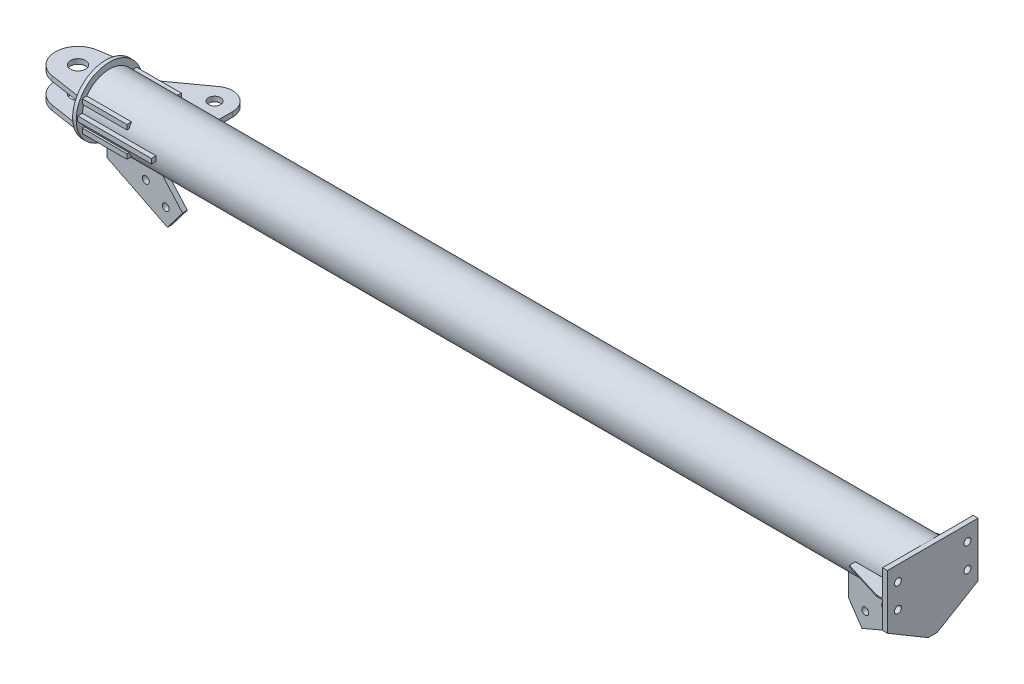
from build123d import *

# Parameters (mm, degrees)
SKETCH_2_R           = 90
EXTRUDE_1_DEPTH      = 2710
EXTRUDE_2_DEPTH      = 16
SKETCH_4_R           = 11.5
CUT_EXTRUDE_1_DEPTH  = 2736.411486413
SKETCH_5_W           = 300
SKETCH_5_H           = 4
EXTRUDE_3_DEPTH      = 150
CUT_EXTRUDE_2_DEPTH  = 2736.287919032
SKETCH_7_W           = 16
SKETCH_7_H           = 260
EXTRUDE_4_DEPTH      = 255
CUT_EXTRUDE_3_DEPTH  = 2743.925445578
CUT_EXTRUDE_4_DEPTH  = 2743.925445578
SKETCH_11_R          = 11.5
CUT_EXTRUDE_5_DEPTH  = 2743.925445578
SKETCH_12_R          = 110
EXTRUDE_5_DEPTH      = 12
SKETCH_14_W          = 16
SKETCH_14_H          = 260
EXTRUDE_6_DEPTH      = 250
CUT_EXTRUDE_7_DEPTH  = 2743.925445578
CUT_EXTRUDE_8_DEPTH  = 2743.925445578
SKETCH_17_R          = 11.5
CUT_EXTRUDE_9_DEPTH  = 2743.925445578
SKETCH_18_W          = 180
SKETCH_18_H          = 16
EXTRUDE_7_DEPTH      = 167
CUT_EXTRUDE_10_DEPTH = 2739.188452244
CUT_EXTRUDE_11_DEPTH = 2739.188452244
SKETCH_21_R          = 25
CUT_EXTRUDE_12_DEPTH = 2739.188452244
SKETCH_22_W          = 180
SKETCH_22_H          = 16
EXTRUDE_8_DEPTH      = 160
SKETCH_23_W          = 244
SKETCH_23_H          = 16
EXTRUDE_9_DEPTH      = 329
CUT_EXTRUDE_13_DEPTH = 2747.77192355
CUT_EXTRUDE_14_DEPTH = 2747.77192355
SKETCH_27_R          = 20
CUT_EXTRUDE_15_DEPTH = 2747.77192355


with BuildPart() as part:
    # 草图2 → 凸台-拉伸1 (new body)
    with BuildSketch(Plane(origin=(0, 0, 0), x_dir=(0, 0, -1), z_dir=(1, 0, 0))):
        Circle(SKETCH_2_R)
    extrude(amount=EXTRUDE_1_DEPTH)

    # 草图3 → 凸台-拉伸2 (add)
    with BuildSketch(Plane(origin=(2710, 0, 0), x_dir=(0, 0, -1), z_dir=(1, 0, 0))):
        Polygon((-150, 90), (150, 90), (150, -90), (15, -170), (-15, -170), (-150, -90), align=None)
    extrude(amount=EXTRUDE_2_DEPTH)

    # 草图4 → 切除-拉伸1 (cut, through all)
    with BuildSketch(Plane(origin=(2726, 0, 0), x_dir=(0, 0, -1), z_dir=(1, 0, 0))):
        with Locations((115, -40)):
            Circle(SKETCH_4_R)
        with Locations((115, 40)):
            Circle(SKETCH_4_R)
        with Locations((-115, 40)):
            Circle(SKETCH_4_R)
        with Locations((-115, -40)):
            Circle(SKETCH_4_R)
    extrude(amount=-CUT_EXTRUDE_1_DEPTH, mode=Mode.SUBTRACT)

    # 草图5 → 凸台-拉伸3 (add)
    with BuildSketch(Plane.ZY.offset(-2710)):
        Rectangle(SKETCH_5_W, SKETCH_5_H)
    extrude(amount=EXTRUDE_3_DEPTH)

    # 草图6 → 切除-拉伸2 (cut, through all)
    with BuildSketch(Plane.XZ.offset(2)):
        Polygon((2690, 150), (2560, 109.977775034), (2560, 150), align=None)
        Polygon((2560, -109.977775034), (2560, -150), (2690, -150), align=None)
    extrude(amount=-CUT_EXTRUDE_2_DEPTH, mode=Mode.SUBTRACT)

    # 草图7 → 凸台-拉伸4 (add)
    with BuildSketch(Plane.ZY.offset(-2710)):
        with Locations((0, -130)):
            Rectangle(SKETCH_7_W, SKETCH_7_H)
    extrude(amount=EXTRUDE_4_DEPTH)

    # 草图9 → 切除-拉伸3 (cut, through all)
    with BuildSketch(Plane(origin=(0, 0, -8), x_dir=(-1, 0, 0), z_dir=(0, 0, -1))):
        Polygon((-2710, -260), (-2500, -260), (-2710, -170), align=None)
    extrude(amount=-CUT_EXTRUDE_3_DEPTH, mode=Mode.SUBTRACT)

    # 草图10 → 切除-拉伸4 (cut, through all)
    with BuildSketch(Plane(origin=(0, 0, -8), x_dir=(-1, 0, 0), z_dir=(0, 0, -1))):
        Polygon((-2500, -260), (-2455, -194), (-2455, -260), align=None)
    extrude(amount=-CUT_EXTRUDE_4_DEPTH, mode=Mode.SUBTRACT)

    # 草图11 → 切除-拉伸5 (cut, through all)
    with BuildSketch(Plane(origin=(0, 0, -8), x_dir=(-1, 0, 0), z_dir=(0, 0, -1))):
        with Locations((-2576.544239322, -159.650616434)):
            Circle(SKETCH_11_R)
        with Locations((-2510.599342676, -204.94157145)):
            Circle(SKETCH_11_R)
    extrude(amount=-CUT_EXTRUDE_5_DEPTH, mode=Mode.SUBTRACT)

    # 草图12 → 凸台-拉伸5 (add)
    with BuildSketch(Plane.ZY):
        Circle(SKETCH_12_R)
    extrude(amount=EXTRUDE_5_DEPTH)

    # 草图14 → 凸台-拉伸6 (add)
    with BuildSketch(Plane(origin=(0, 0, 0), x_dir=(0, 0, -1), z_dir=(1, 0, 0))):
        with Locations((0, -130)):
            Rectangle(SKETCH_14_W, SKETCH_14_H)
    extrude(amount=EXTRUDE_6_DEPTH)

    # 草图15 → 切除-拉伸7 (cut, through all)
    with BuildSketch(Plane(origin=(0, 0, -8), x_dir=(-1, 0, 0), z_dir=(0, 0, -1))):
        Polygon((-250, -194), (-250, -89.643739324), (-158, -89.643739324), align=None)
        Polygon((-200, -260), (0, -160), (0, -260), align=None)
    extrude(amount=-CUT_EXTRUDE_7_DEPTH, mode=Mode.SUBTRACT)

    # 草图16 → 切除-拉伸8 (cut, through all)
    with BuildSketch(Plane(origin=(0, 0, -8), x_dir=(-1, 0, 0), z_dir=(0, 0, -1))):
        Polygon((-250, -260), (-200, -260), (-250, -194), align=None)
    extrude(amount=-CUT_EXTRUDE_8_DEPTH, mode=Mode.SUBTRACT)

    # 草图17 → 切除-拉伸9 (cut, through all)
    with BuildSketch(Plane(origin=(0, 0, -8), x_dir=(-1, 0, 0), z_dir=(0, 0, -1))):
        with Locations((-128.455760678, -159.650616434)):
            Circle(SKETCH_17_R)
        with Locations((-194.400657324, -204.94157145)):
            Circle(SKETCH_17_R)
    extrude(amount=-CUT_EXTRUDE_9_DEPTH, mode=Mode.SUBTRACT)

    # 草图18 → 凸台-拉伸7 (add)
    with BuildSketch(Plane.ZY.offset(12)):
        with Locations((0, 42)):
            Rectangle(SKETCH_18_W, SKETCH_18_H)
        with Locations((0, -42)):
            Rectangle(SKETCH_18_W, SKETCH_18_H)
    extrude(amount=EXTRUDE_7_DEPTH)

    # 草图19 → 切除-拉伸10 (cut, through all)
    with BuildSketch(Plane.XZ.offset(50)):
        with BuildLine():
            Line((-115.378912249, 74.131776965), (-12, 90))
            Line((-12, 90), (-179, 90))
            Line((-179, 90), (-179, 0))
            ThreePointArc((-179, 0), (-160.914051071, 48.844557431), (-115.378912249, 74.131776965))
        make_face()
    extrude(amount=-CUT_EXTRUDE_10_DEPTH, mode=Mode.SUBTRACT)

    # 草图20 → 切除-拉伸11 (cut, through all)
    with BuildSketch(Plane.XZ.offset(50)):
        with BuildLine():
            Line((-115.378912249, -74.131776965), (-12, -90))
            Line((-12, -90), (-179, -90))
            Line((-179, -90), (-179, 0))
            ThreePointArc((-179, 0), (-160.914051071, -48.844557431), (-115.378912249, -74.131776965))
        make_face()
    extrude(amount=-CUT_EXTRUDE_11_DEPTH, mode=Mode.SUBTRACT)

    # 草图21 → 切除-拉伸12 (cut, through all)
    with BuildSketch(Plane.XZ.offset(50)):
        with Locations((-104, 0)):
            Circle(SKETCH_21_R)
    extrude(amount=-CUT_EXTRUDE_12_DEPTH, mode=Mode.SUBTRACT)

    # 草图22 → 凸台-拉伸8 (add)
    with BuildSketch(Plane.ZY.offset(12)):
        with Locations((0, 42)):
            Rectangle(SKETCH_22_W, SKETCH_22_H)
        with Locations((0, -42)):
            Rectangle(SKETCH_22_W, SKETCH_22_H)
    extrude(amount=-EXTRUDE_8_DEPTH)

    # 草图23 → 凸台-拉伸9 (add)
    with BuildSketch(Plane.XY.offset(105)):
        with Locations((122, 0)):
            Rectangle(SKETCH_23_W, SKETCH_23_H)
    extrude(amount=-EXTRUDE_9_DEPTH)

    # 草图25 → 切除-拉伸13 (cut, through all)
    with BuildSketch(Plane(origin=(0, -8, 0), x_dir=(-1, 0, 0), z_dir=(0, -1, 0))):
        with BuildLine():
            Line((-244, 164), (-244, 224))
            Line((-244, 224), (-184, 224))
            ThreePointArc((-184, 224), (-226.426406871, 206.426406871), (-244, 164))
        make_face()
    extrude(amount=-CUT_EXTRUDE_13_DEPTH, mode=Mode.SUBTRACT)

    # 草图26 → 切除-拉伸14 (cut, through all)
    with BuildSketch(Plane.XZ.offset(8)):
        with BuildLine():
            Line((148.844142163, -212.62165834), (0, -105))
            Line((0, -105), (0, -224))
            Line((0, -224), (184, -224))
            ThreePointArc((184, -224), (165.524333576, -221.084584173), (148.844142163, -212.62165834))
        make_face()
    extrude(amount=-CUT_EXTRUDE_14_DEPTH, mode=Mode.SUBTRACT)

    # 草图27 → 切除-拉伸15 (cut, through all)
    with BuildSketch(Plane.XZ.offset(8)):
        with Locations((184, -164)):
            Circle(SKETCH_27_R)
    extrude(amount=-CUT_EXTRUDE_15_DEPTH, mode=Mode.SUBTRACT)


solid = part.part
